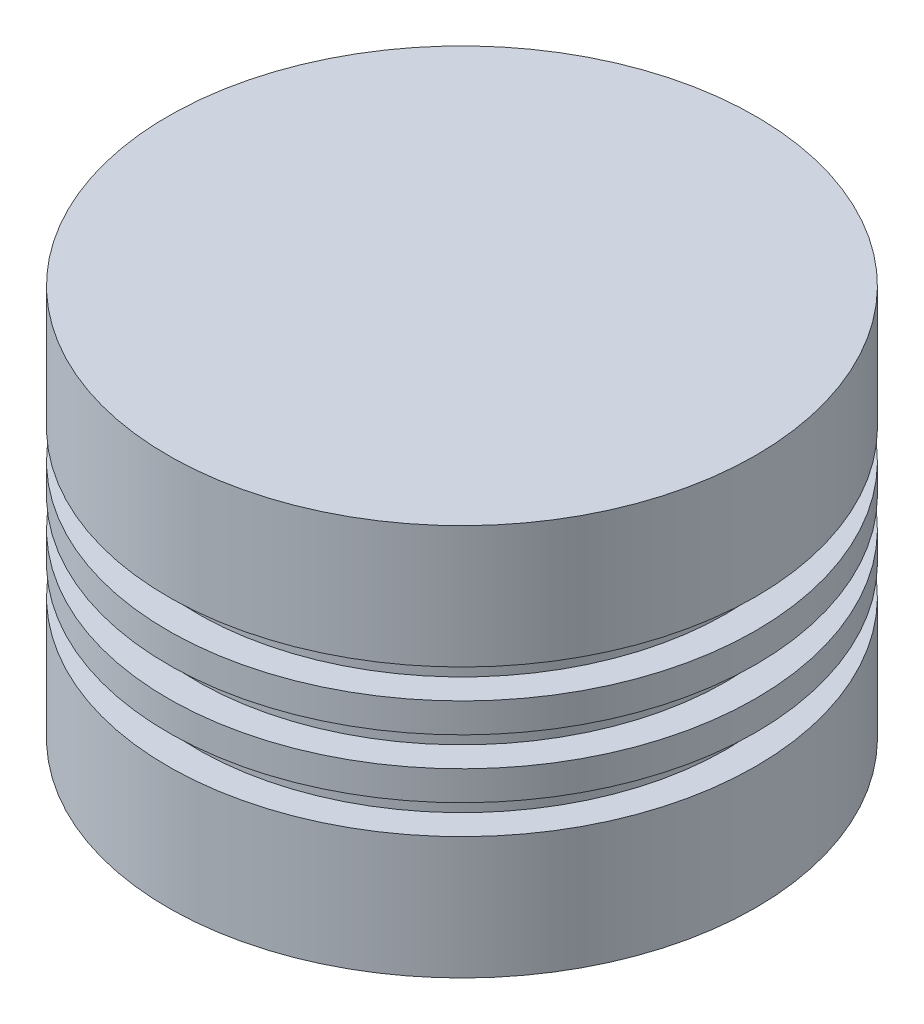
from build123d import *

# Parameters (mm, degrees)
SKETCH2_W           = 62.5
SKETCH2_H           = 62.5
CUT_EXTRUDE1_DEPTH  = 50
BOSS_EXTRUDE1_REACH = 166.055
SKETCH3_R           = 10
FILLET1_R           = 25


with BuildPart() as part:
    # Sketch1 → Revolve1 (revolve)
    with BuildSketch(Plane.XY, mode=Mode.PRIVATE) as revolve1_sk:
        Polygon((0, 0), (0, 100), (-75, 100), (-75, 68.75), (-67.5, 68.75), (-67.5, 61.25), (-75, 61.25), (-75, 53.75), (-67.5, 53.75), (-67.5, 46.25), (-75, 46.25), (-75, 38.75), (-67.5, 38.75), (-67.5, 31.25), (-75, 31.25), (-75, 0), align=None)
    revolve(revolve1_sk.sketch.rotate(Axis((0, 0, 0), (0, 1, 0)), 180), axis=Axis((0, 0, 0), (0, 1, 0)))

    # Sketch2 → Cut-Extrude1 (cut)
    with BuildSketch(Plane.XZ):
        Rectangle(SKETCH2_W, SKETCH2_H)
    extrude(amount=-CUT_EXTRUDE1_DEPTH, mode=Mode.SUBTRACT)

    # Sketch3 → Boss-Extrude1 (add, up to next)
    with BuildSketch(Plane.ZY.offset(-31.25), mode=Mode.PRIVATE) as boss_extrude1_sk1:
        with Locations(Location((0, 25, 0), (0, 0, 180))):
            Circle(SKETCH3_R)
    boss_extrude1_tool1 = extrude(boss_extrude1_sk1.sketch, amount=BOSS_EXTRUDE1_REACH, mode=Mode.PRIVATE) - part.part
    add(boss_extrude1_tool1.solids().sort_by_distance((31.25, 25, 0))[0])

    # Fillet1
    fillet1_edges = [part.edges().sort_by_distance(p)[0] for p in [
        (0, 50, -31.25),
        (0, 50, 31.25),
    ]]
    fillet(fillet1_edges, radius=FILLET1_R)


solid = part.part
